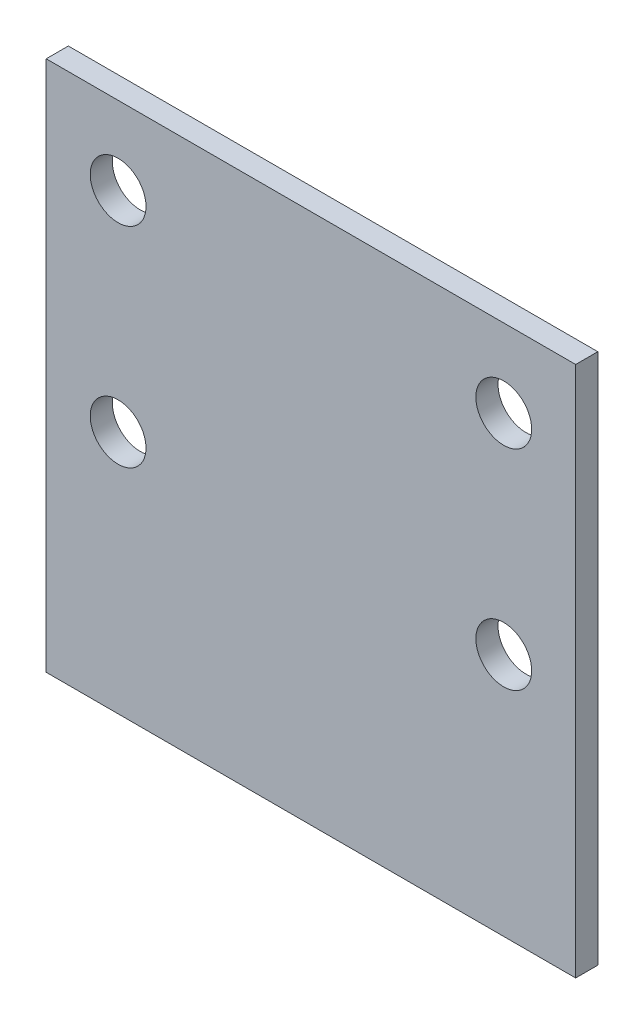
from build123d import *

# Parameters (mm, degrees)
SKETCH1_W           = 75.93
SKETCH1_H           = 76.2
SKETCH1_R           = 4
BOSS_EXTRUDE1_DEPTH = 3.175


with BuildPart() as part:
    # Sketch1 → Boss-Extrude1 (new body)
    with BuildSketch(Plane.XY):
        with Locations((12.565, 38.1)):
            Rectangle(SKETCH1_W, SKETCH1_H)
        with Locations((-15.0876, 65)):
            Circle(SKETCH1_R, mode=Mode.SUBTRACT)
        with Locations((-15.0876, 35)):
            Circle(SKETCH1_R, mode=Mode.SUBTRACT)
        with Locations((40.2176, 65)):
            Circle(SKETCH1_R, mode=Mode.SUBTRACT)
        with Locations((40.2176, 35)):
            Circle(SKETCH1_R, mode=Mode.SUBTRACT)
    extrude(amount=BOSS_EXTRUDE1_DEPTH)


solid = part.part
